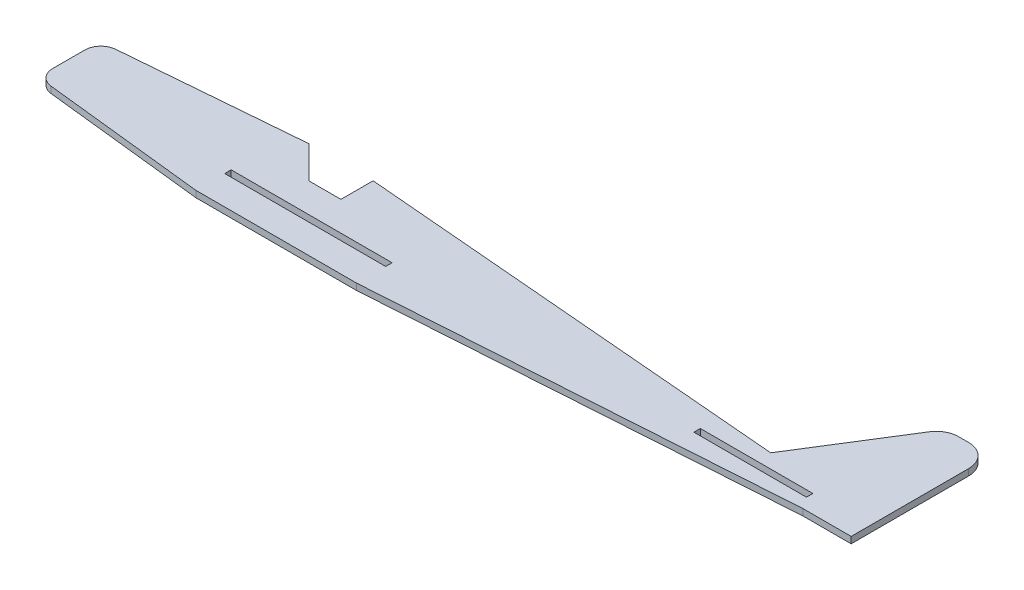
from build123d import *

# Parameters (mm, degrees)
SKETCH1_W           = 50
SKETCH1_H           = 2
BOSS_EXTRUDE1_DEPTH = 2
SKETCH6_W           = 35
SKETCH6_H           = 2
CUT_EXTRUDE1_DEPTH  = 2


with BuildPart() as part:
    # Sketch1 → Boss-Extrude1 (new body)
    with BuildSketch(Plane(origin=(0, 0, 0), x_dir=(1, 0, 0), z_dir=(0, 1, 0))):
        with BuildLine():
            Line((-120.405540847, 10.840369707), (-64.990311195, 15.45833074))
            Line((-64.990311195, 15.45833074), (-54.990311195, 5.45833074))
            Line((-54.990311195, 5.45833074), (-44.990311195, 5.45833074))
            Line((-44.990311195, 5.45833074), (-44.990311195, 15.45833074))
            Line((-44.990311195, 15.45833074), (90.009688805, 4.0256009))
            Line((90.009688805, 4.0256009), (108.952709235, 34.277770331))
            ThreePointArc((108.952709235, 34.277770331), (111.494770003, 36.686709078), (114.88557379, 37.562784709))
            Line((114.88557379, 37.562784709), (118.009688805, 37.562784709))
            ThreePointArc((118.009688805, 37.562784709), (122.959436273, 35.512532177), (125.009688805, 30.562784709))
            Line((125.009688805, 30.562784709), (125.009688805, 15.562784709))
            Line((125.009688805, 15.562784709), (125.009688805, -5.9743991))
            Line((125.009688805, -5.9743991), (110.009688805, -5.9743991))
            Line((110.009688805, -5.9743991), (-19.990311195, -14.651713609))
            Line((-19.990311195, -14.651713609), (-69.990311195, -14.651713609))
            Line((-69.990311195, -14.651713609), (-120.534992278, -9.112602605))
            ThreePointArc((-120.534992278, -9.112602605), (-123.713441962, -7.479767666), (-124.990311195, -4.142358897))
            Line((-124.990311195, -4.142358897), (-124.990311195, 5.857641103))
            ThreePointArc((-124.990311195, 5.857641103), (-123.669723394, 9.243187717), (-120.405540847, 10.840369707))
        make_face()
        with Locations((-44.990311195, -4.651713609)):
            Rectangle(SKETCH1_W, SKETCH1_H, mode=Mode.SUBTRACT)
    extrude(amount=BOSS_EXTRUDE1_DEPTH)

    # Sketch6 → Cut-Extrude1 (cut)
    with BuildSketch(Plane(origin=(0, 2, 0), x_dir=(1, 0, 0), z_dir=(0, 1, 0))):
        with Locations((90.009688805, -1.362235571)):
            Rectangle(SKETCH6_W, SKETCH6_H)
    extrude(amount=-CUT_EXTRUDE1_DEPTH, mode=Mode.SUBTRACT)


solid = part.part
